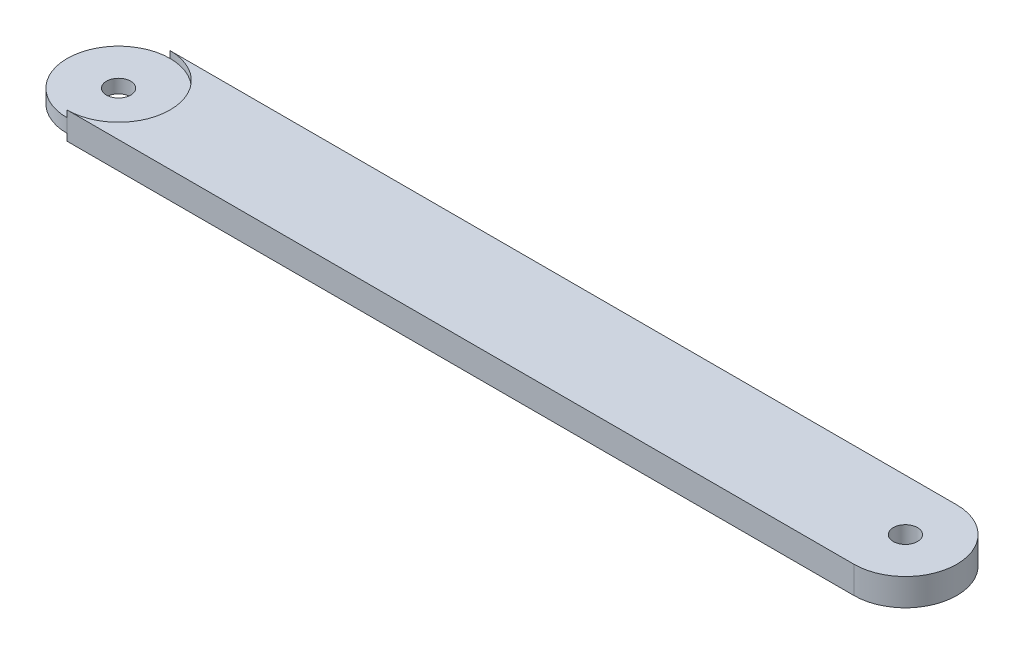
from build123d import *

# Parameters (mm, degrees)
BOSS_EXTRU_1_DEPTH      = 8
ESQUISSE2_R             = 7.15
ENL_V_MAT_EXTRU_1_DEPTH = 265.732643435
ESQUISSE3_R             = 30.35
ENL_V_MAT_EXTRU_4_DEPTH = 4
ESQUISSE4_R             = 7.15
ENL_V_MAT_EXTRU_5_DEPTH = 265.521024684


with BuildPart() as part:
    # Esquisse1 → Boss.-Extru.1 (new, symmetric)
    with BuildSketch(Plane(origin=(0, 0, 0), x_dir=(1, 0, 0), z_dir=(0, 1, 0))):
        with BuildLine():
            Line((-232.15, 30.35), (232.15, 30.35))
            ThreePointArc((232.15, 30.35), (262.5, 0), (232.15, -30.35))
            Line((232.15, -30.35), (-232.15, -30.35))
            ThreePointArc((-232.15, -30.35), (-262.5, 0), (-232.15, 30.35))
        make_face()
    extrude(amount=BOSS_EXTRU_1_DEPTH, both=True)

    # Esquisse2 → Enlèv. mat.-Extru.1 (cut, through all)
    with BuildSketch(Plane(origin=(0, 8, 0), x_dir=(1, 0, 0), z_dir=(0, 1, 0))):
        with Locations(Location((232.15, 0, 0), (0, 0, 270))):
            Circle(ESQUISSE2_R)
    extrude(amount=-ENL_V_MAT_EXTRU_1_DEPTH, mode=Mode.SUBTRACT)

    # Esquisse3 → Enlèv. mat.-Extru.4 (cut)
    with BuildSketch(Plane(origin=(0, 8, 0), x_dir=(1, 0, 0), z_dir=(0, 1, 0))):
        with Locations((-232.15, 0)):
            Circle(ESQUISSE3_R)
    enl_v_mat_extru_4 = extrude(amount=-ENL_V_MAT_EXTRU_4_DEPTH, mode=Mode.SUBTRACT)

    # Symétrie4: Enlèv. mat.-Extru.4 across plane
    add(enl_v_mat_extru_4.mirror(Plane.ZX), mode=Mode.SUBTRACT)

    # Esquisse4 → Enlèv. mat.-Extru.5 (cut, through all)
    with BuildSketch(Plane(origin=(0, 4, 0), x_dir=(1, 0, 0), z_dir=(0, 1, 0))):
        with Locations(Location((-232.15, 0, 0), (0, 0, 270))):
            Circle(ESQUISSE4_R)
    extrude(amount=-ENL_V_MAT_EXTRU_5_DEPTH, mode=Mode.SUBTRACT)


solid = part.part
